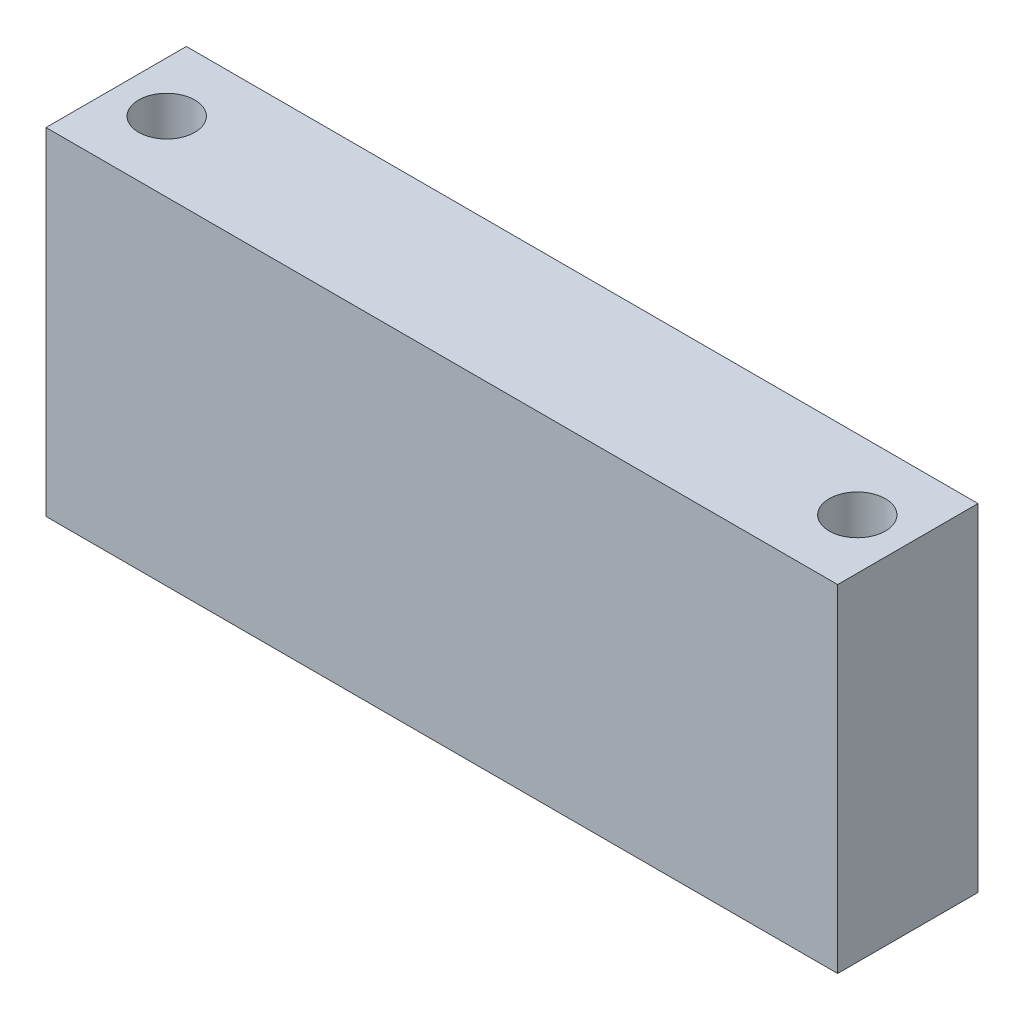
from build123d import *

# Parameters (mm, degrees)
SKETCH2_W           = 35.814
SKETCH2_H           = 6.35
BOSS_EXTRUDE1_DEPTH = 15.24
SKETCH3_R           = 1.27
CUT_EXTRUDE1_DEPTH  = 40.436311897


with BuildPart() as part:
    # Sketch2 → Boss-Extrude1 (new body)
    with BuildSketch(Plane(origin=(0, 0, 0), x_dir=(1, 0, 0), z_dir=(0, 1, 0))):
        with Locations((17.907, 3.175)):
            Rectangle(SKETCH2_W, SKETCH2_H)
    extrude(amount=BOSS_EXTRUDE1_DEPTH)

    # Sketch3 → Cut-Extrude1 (cut, through all)
    with BuildSketch(Plane.XZ):
        with Locations(Location((2.286, -3.175, 0), (0, 0, 270))):
            Circle(SKETCH3_R)
        with Locations(Location((33.528, -3.175, 0), (0, 0, 270))):
            Circle(SKETCH3_R)
    extrude(amount=-CUT_EXTRUDE1_DEPTH, mode=Mode.SUBTRACT)


solid = part.part
